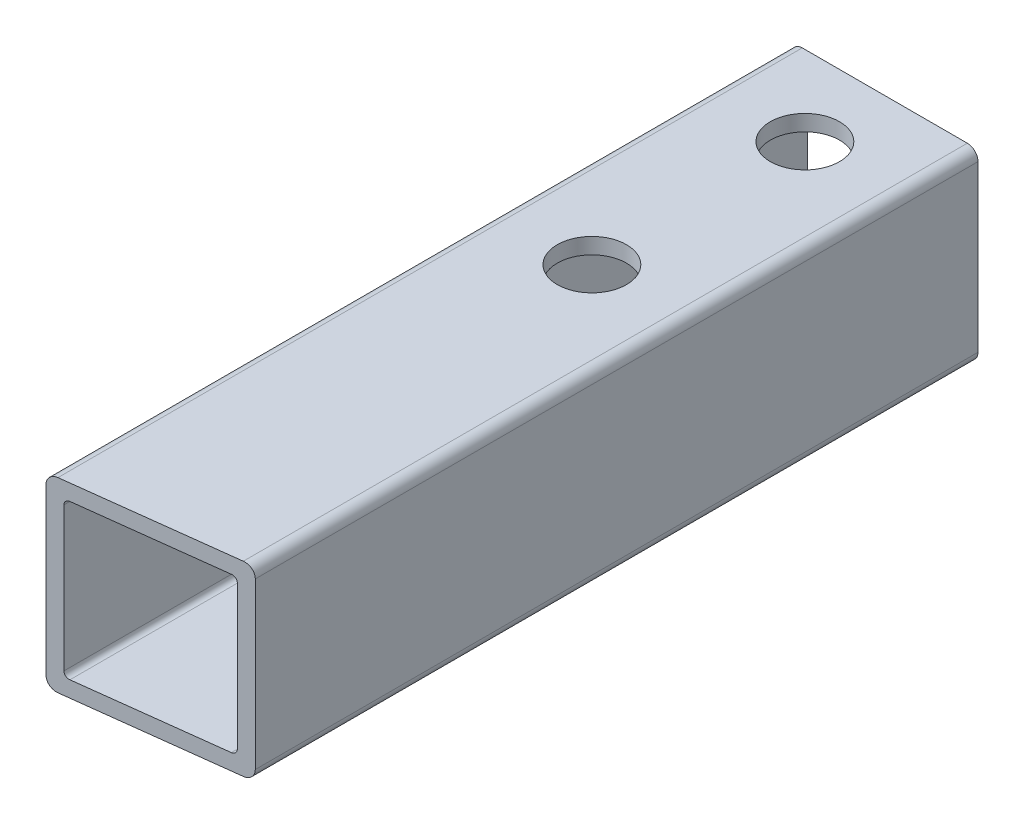
from build123d import *

# Parameters (mm, degrees)
DODANIE_WYCI_GNI_CIE1_DEPTH = 140
SZKIC2_R                    = 6.5
WYTNIJ_WYCI_GNI_CIE1_DEPTH  = 140


with BuildPart() as part:
    # Szkic1 → Dodanie-wyciągnięcie1 (new body)
    with BuildSketch(Plane.XY):
        with BuildLine():
            Line((-15.5, 0), (15.5, 0))
            ThreePointArc((15.5, 0), (16.914213562, 0.585786438), (17.5, 2))
            Line((17.5, 2), (17.5, 33))
            ThreePointArc((17.5, 33), (16.914213562, 34.414213562), (15.5, 35))
            Line((15.5, 35), (-15.5, 35))
            ThreePointArc((-15.5, 35), (-16.914213562, 34.414213562), (-17.5, 33))
            Line((-17.5, 33), (-17.5, 2))
            ThreePointArc((-17.5, 2), (-16.914213562, 0.585786438), (-15.5, 0))
        make_face()
        with BuildLine():
            Line((-13.5, 3), (13.5, 3))
            ThreePointArc((13.5, 3), (14.207106781, 3.292893219), (14.5, 4))
            Line((14.5, 4), (14.5, 31))
            ThreePointArc((14.5, 31), (14.207106781, 31.707106781), (13.5, 32))
            Line((13.5, 32), (-13.5, 32))
            ThreePointArc((-13.5, 32), (-14.207106781, 31.707106781), (-14.5, 31))
            Line((-14.5, 31), (-14.5, 4))
            ThreePointArc((-14.5, 4), (-14.207106781, 3.292893219), (-13.5, 3))
        make_face(mode=Mode.SUBTRACT)
    extrude(amount=DODANIE_WYCI_GNI_CIE1_DEPTH)

    # Szkic2 → Wytnij-wyciągnięcie1 (cut)
    with BuildSketch(Plane(origin=(0, 35, 0), x_dir=(1, 0, 0), z_dir=(0, 1, 0))):
        with Locations(Location((0, -15, 0), (0, 0, 180))):
            Circle(SZKIC2_R)
        with Locations(Location((0, -55, 0), (0, 0, 180))):
            Circle(SZKIC2_R)
        Polygon((-17.5, -140), (23.891746827, -134.917732541), (23.891746827, -140), align=None)
    extrude(amount=-WYTNIJ_WYCI_GNI_CIE1_DEPTH, mode=Mode.SUBTRACT)


solid = part.part
